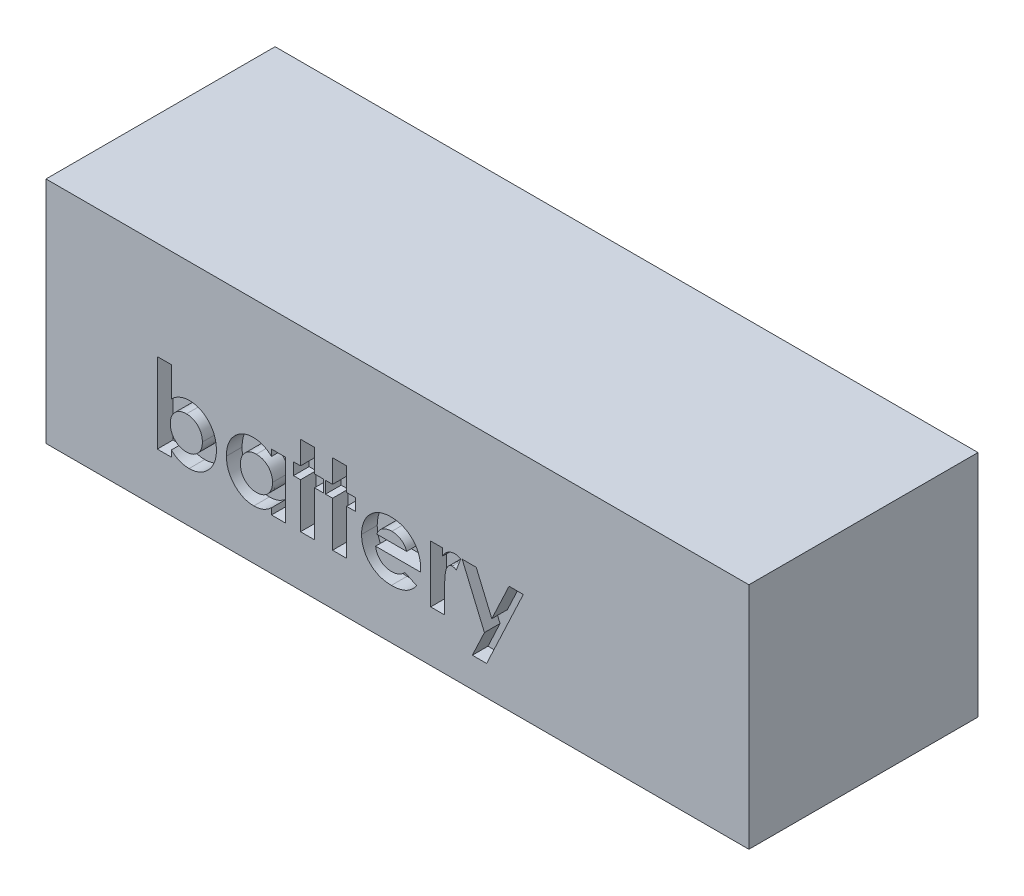
from build123d import *

# Parameters (mm, degrees)
SKETCH_1_W          = 135
SKETCH_1_H          = 44
EXTRUDE_1_DEPTH     = 44
CUT_EXTRUDE_1_DEPTH = 3


with BuildPart() as part:
    # ｽｹｯﾁ1 → ﾎﾞｽ - 押し出し1 (new body)
    with BuildSketch(Plane.XY):
        with Locations((67.5, 22)):
            Rectangle(SKETCH_1_W, SKETCH_1_H)
    extrude(amount=EXTRUDE_1_DEPTH)

    # ｽｹｯﾁ2 → ｶｯﾄ - 押し出し1 (cut)
    # profile 1 of 7: a face of its own
    with BuildSketch(Plane.XY.offset(44)):
        with BuildLine():
            Line((24.074722229, 25.14774532), (24.074722229, 19.447625128))
            add(Edge.make_bspline(
                [(24.074722229, 19.447625128), (24.199740685, 19.565337539), (24.445158571, 19.79641327), (24.845857096, 20.095219483), (25.260933041, 20.347409477), (25.690014561, 20.558985084), (26.136963428, 20.715436123), (26.596288067, 20.837004441), (27.072695046, 20.901389585), (27.394868954, 20.911751888), (27.557294345, 20.916976089)],
                knots=[0, 0, 0, 0, 1.061187343, 2.083167259, 3.083809127, 4.061667593, 5.035358583, 6.007314429, 6.995378812, 8, 8, 8, 8], degree=3))
            add(Edge.make_bspline(
                [(27.557294345, 20.916976089), (27.733852947, 20.912747065), (28.081616104, 20.904417261), (28.59328342, 20.826646571), (29.083624154, 20.700935602), (29.554508103, 20.525408828), (30.00342645, 20.297516625), (30.435423114, 20.024658742), (30.843047804, 19.695575564), (31.226498678, 19.322833687), (31.581200289, 18.914280901), (31.889725368, 18.470097312), (32.146714786, 17.996129229), (32.364525944, 17.497979945), (32.523493276, 16.967387819), (32.646012031, 16.41147039), (32.714286357, 15.825524477), (32.723746, 15.426355734), (32.728568383, 15.222865512)],
                knots=[0, 0, 0, 0, 0.985987466, 1.942075377, 2.884088208, 3.810275091, 4.743821533, 5.692411115, 6.659945104, 7.665215984, 8.677116751, 9.678438675, 10.680260931, 11.685531812, 12.710472044, 13.769734641, 14.863044265, 16, 16, 16, 16], degree=3))
            add(Edge.make_bspline(
                [(32.728568383, 15.222865512), (32.724004319, 15.026341303), (32.715007541, 14.638948756), (32.642319248, 14.07022462), (32.519118679, 13.526931847), (32.346293248, 13.008874775), (32.126585563, 12.514416254), (31.858417169, 12.043896993), (31.540223782, 11.598960505), (31.176446629, 11.185600535), (30.778967225, 10.811272353), (30.364822177, 10.47542555), (29.925763077, 10.200225432), (29.472765421, 9.967797849), (28.99869278, 9.790064974), (28.506783278, 9.665543118), (27.997815979, 9.582292533), (27.651780207, 9.574683754), (27.476164537, 9.570822243)],
                knots=[0, 0, 0, 0, 1.098553145, 2.165490463, 3.199345634, 4.208780719, 5.21409072, 6.219899742, 7.23156933, 8.267303578, 9.293302409, 10.281606823, 11.243293419, 12.184993323, 13.124258899, 14.066907486, 15.018941492, 16, 16, 16, 16], degree=3))
            add(Edge.make_bspline(
                [(27.476164537, 9.570822243), (27.319730468, 9.575004139), (27.011700412, 9.583238596), (26.557651289, 9.644311662), (26.121326568, 9.747024792), (25.697214428, 9.888512791), (25.284164117, 10.081826998), (24.874982354, 10.323541124), (24.467035734, 10.616713412), (24.208125782, 10.842636401), (24.074722229, 10.959043397)],
                knots=[0, 0, 0, 0, 0.996418773, 1.962021009, 2.912343664, 3.848616743, 4.805003894, 5.811808768, 6.872532775, 8, 8, 8, 8], degree=3))
            Line((24.074722229, 10.959043397), (24.074722229, 9.763129935))
            Line((24.074722229, 9.763129935), (21.382414537, 9.763129935))
            Line((21.382414537, 9.763129935), (21.382414537, 25.14774532))
            Line((21.382414537, 25.14774532), (24.074722229, 25.14774532))
        make_face()
        with BuildLine():
            add(Edge.make_bspline(
                [(26.974361653, 18.416976089), (26.865099774, 18.413616211), (26.650887096, 18.407029024), (26.33638387, 18.369277884), (26.038386525, 18.298248837), (25.752364254, 18.20618792), (25.481938922, 18.081920142), (25.224898143, 17.931282049), (24.983443495, 17.751657623), (24.756321835, 17.550159769), (24.552234967, 17.323474304), (24.370921489, 17.081249127), (24.220497806, 16.820330011), (24.095103271, 16.544025378), (24.000498573, 16.249345641), (23.930329296, 15.938797645), (23.892196742, 15.611429699), (23.885726844, 15.388220613), (23.882414537, 15.273947243)],
                knots=[0, 0, 0, 0, 1.060469436, 2.079096586, 3.066888298, 4.028858836, 4.99004353, 5.948472697, 6.914558426, 7.905691313, 8.889602648, 9.869280844, 10.836099585, 11.806137001, 12.808075328, 13.83377171, 14.890985086, 16, 16, 16, 16], degree=3))
            add(Edge.make_bspline(
                [(23.882414537, 15.273947243), (23.885768523, 15.157673996), (23.892350864, 14.929482742), (23.930165535, 14.595134114), (23.999842295, 14.278364407), (24.096439546, 13.978455425), (24.219700324, 13.695368255), (24.369945783, 13.428053453), (24.553255054, 13.182371758), (24.755099952, 12.949709575), (24.983625962, 12.745515637), (25.223992851, 12.562381763), (25.481876475, 12.411519127), (25.753594179, 12.289284732), (26.037084193, 12.187708619), (26.336571059, 12.119073744), (26.650837426, 12.080622492), (26.865082997, 12.07413253), (26.974361653, 12.070822243)],
                knots=[0, 0, 0, 0, 1.117193555, 2.192540452, 3.22680955, 4.227918444, 5.21468246, 6.188555072, 7.166222992, 8.154674427, 9.142376254, 10.104580718, 11.053462639, 12.005072638, 12.963662044, 13.941614018, 14.950094269, 16, 16, 16, 16], degree=3))
            add(Edge.make_bspline(
                [(26.974361653, 12.070822243), (27.079665331, 12.073897398), (27.288106209, 12.079984442), (27.593090526, 12.122457697), (27.886256438, 12.191863216), (28.165308067, 12.290791188), (28.43194411, 12.419595308), (28.688591945, 12.570317446), (28.926391124, 12.758633506), (29.154670906, 12.965608932), (29.358920323, 13.199017685), (29.542156597, 13.446983743), (29.696080512, 13.711720254), (29.818292473, 13.994105123), (29.919328586, 14.28878957), (29.988309127, 14.60116734), (30.026260957, 14.928450238), (30.032894331, 15.151657649), (30.036260691, 15.26493282)],
                knots=[0, 0, 0, 0, 1.021711385, 2.02240246, 2.981887075, 3.941027022, 4.888772411, 5.852236371, 6.822344989, 7.82661704, 8.838806642, 9.826383926, 10.814965113, 11.80282933, 12.807900643, 13.833672313, 14.900613836, 16, 16, 16, 16], degree=3))
            add(Edge.make_bspline(
                [(30.036260691, 15.26493282), (30.032840572, 15.377188896), (30.026101979, 15.598364795), (29.988927322, 15.922922302), (29.917290925, 16.230758637), (29.826840855, 16.524388597), (29.700473999, 16.799989885), (29.551057934, 17.060822821), (29.37524225, 17.30767497), (29.171288482, 17.533882533), (28.947587146, 17.739715164), (28.708789779, 17.921775824), (28.455834161, 18.076761318), (28.185275591, 18.198984936), (27.903498823, 18.299548632), (27.606197721, 18.368818236), (27.294883736, 18.40715591), (27.082637311, 18.413658731), (26.974361653, 18.416976089)],
                knots=[0, 0, 0, 0, 1.094680664, 2.156827393, 3.177782763, 4.17210342, 5.146667393, 6.126451192, 7.099203661, 8.094961544, 9.09004898, 10.058676268, 11.018205477, 11.974998356, 12.947750825, 13.930643515, 14.944335875, 16, 16, 16, 16], degree=3))
        make_face(mode=Mode.SUBTRACT)
    # profile 2 of 7: a face of its own
    with BuildSketch(Plane.XY.offset(44)):
        with BuildLine():
            Line((43.30549146, 20.724668397), (45.997799153, 20.724668397))
            Line((45.997799153, 20.724668397), (45.997799153, 9.763129935))
            Line((45.997799153, 9.763129935), (43.30549146, 9.763129935))
            Line((43.30549146, 9.763129935), (43.30549146, 10.959043397))
            add(Edge.make_bspline(
                [(43.30549146, 10.959043397), (43.172088606, 10.842634457), (42.91318001, 10.616707694), (42.505223842, 10.323561975), (42.096075578, 10.081754643), (41.683769251, 9.88916829), (41.261967884, 9.74696309), (40.827634678, 9.644003204), (40.374514772, 9.58328524), (40.066490102, 9.575019849), (39.910058768, 9.570822243)],
                knots=[0, 0, 0, 0, 1.129196829, 2.191548051, 3.199897424, 4.157751732, 5.089409408, 6.034969131, 7.002052659, 8, 8, 8, 8], degree=3))
            add(Edge.make_bspline(
                [(39.910058768, 9.570822243), (39.734457642, 9.574772719), (39.387459864, 9.582579084), (38.878279148, 9.664753667), (38.386614546, 9.790540183), (37.912865152, 9.968543825), (37.457892911, 10.199201648), (37.018215905, 10.476495468), (36.601371537, 10.810159956), (36.203889722, 11.1857583), (35.839957755, 11.598919151), (35.521804995, 12.043907893), (35.253625863, 12.514413342), (35.033921051, 13.008875558), (34.861094844, 13.526931632), (34.737894488, 14.07022468), (34.665206137, 14.638948741), (34.656209367, 15.026341298), (34.651645306, 15.222865512)],
                knots=[0, 0, 0, 0, 0.980476535, 1.937477201, 2.874147792, 3.812856188, 4.758993464, 5.720109578, 6.712210464, 7.737600662, 8.772720504, 9.783789959, 10.789002326, 11.793715968, 12.802552247, 13.835794126, 14.902098527, 16, 16, 16, 16], degree=3))
            add(Edge.make_bspline(
                [(34.651645306, 15.222865512), (34.656435305, 15.426366594), (34.665831421, 15.825556642), (34.734563449, 16.411349057), (34.855490294, 16.968113012), (35.02038274, 17.496619706), (35.23248824, 17.996960444), (35.490818566, 18.469954945), (35.798888061, 18.914366876), (36.153883542, 19.322632035), (36.537191469, 19.696826773), (36.947263189, 20.022592967), (37.377686076, 20.299346506), (37.82891753, 20.525284794), (38.300893112, 20.699878468), (38.791749471, 20.827520701), (39.303665663, 20.904110523), (39.652387121, 20.912651952), (39.82892896, 20.916976089)],
                knots=[0, 0, 0, 0, 1.136281865, 2.228943489, 3.287578264, 4.313574083, 5.316051562, 6.317280042, 7.318008486, 8.329309503, 9.333984563, 10.305318864, 11.248632312, 12.186624717, 13.117503092, 14.05354244, 15.014596925, 16, 16, 16, 16], degree=3))
            add(Edge.make_bspline(
                [(39.82892896, 20.916976089), (39.992463906, 20.913578616), (40.316040619, 20.906856243), (40.791651764, 20.833864127), (41.252925978, 20.723468735), (41.697346987, 20.566175173), (42.128560078, 20.367560051), (42.539148116, 20.118680498), (42.938093084, 19.829996812), (43.18151224, 19.604528738), (43.30549146, 19.489692435)],
                knots=[0, 0, 0, 0, 1.017011718, 2.012299608, 2.98747302, 3.965332399, 4.941441765, 5.936729654, 6.94912688, 8, 8, 8, 8], degree=3))
            Line((43.30549146, 19.489692435), (43.30549146, 20.724668397))
        make_face()
        with BuildLine():
            add(Edge.make_bspline(
                [(40.393832806, 18.416976089), (40.286552281, 18.413684352), (40.076289457, 18.407232763), (39.767069199, 18.368426004), (39.471547394, 18.300046764), (39.191831682, 18.199031122), (38.923753269, 18.075979352), (38.671382969, 17.921859035), (38.432637894, 17.739692096), (38.208922127, 17.533888793), (38.004972244, 17.307673336), (37.829155541, 17.060823258), (37.679739748, 16.799989768), (37.553372819, 16.524388629), (37.462922769, 16.230758628), (37.391286367, 15.922922305), (37.354111711, 15.598364794), (37.347373118, 15.377188896), (37.343952999, 15.26493282)],
                knots=[0, 0, 0, 0, 1.04836806, 2.054732945, 3.03993516, 4.00574415, 4.955904794, 5.917688631, 6.888591924, 7.88601754, 8.884115178, 9.859153345, 10.841239365, 11.818093293, 12.814750328, 13.83810466, 14.90274714, 16, 16, 16, 16], degree=3))
            add(Edge.make_bspline(
                [(37.343952999, 15.26493282), (37.347320875, 15.151658516), (37.353957236, 14.928452815), (37.391887445, 14.601157546), (37.460946074, 14.288824457), (37.561700009, 13.993978549), (37.684743936, 13.712641376), (37.834516065, 13.446111335), (38.018484893, 13.199101011), (38.222613561, 12.965765309), (38.450918821, 12.757405584), (38.691014813, 12.572401277), (38.946181058, 12.417608292), (39.213649182, 12.292503623), (39.492518876, 12.190553833), (39.78628632, 12.123033981), (40.092073692, 12.079869817), (40.300537018, 12.073858926), (40.405852037, 12.070822243)],
                knots=[0, 0, 0, 0, 1.099136573, 2.165835871, 3.191374663, 4.196217796, 5.183857741, 6.167377911, 7.154730987, 8.166690795, 9.170734848, 10.148332609, 11.103258353, 12.059567475, 13.009337315, 13.978056681, 14.978520572, 16, 16, 16, 16], degree=3))
            add(Edge.make_bspline(
                [(40.405852037, 12.070822243), (40.515130787, 12.074132434), (40.729376544, 12.080622208), (41.043641574, 12.119074814), (41.343133296, 12.187704772), (41.626605664, 12.289298751), (41.898388449, 12.411467253), (42.156029055, 12.562575941), (42.396731692, 12.744324857), (42.621715411, 12.951988628), (42.827869618, 13.180051271), (43.006117727, 13.430138395), (43.161378351, 13.694251527), (43.283483688, 13.978635265), (43.380452449, 14.278314221), (43.450025299, 14.595148265), (43.487868896, 14.929478984), (43.494447216, 15.157672727), (43.497799153, 15.273947243)],
                knots=[0, 0, 0, 0, 1.050008698, 2.058587853, 3.036635738, 3.995319155, 4.947022481, 5.895997462, 6.858296291, 7.838991643, 8.833936038, 9.806048392, 10.784806122, 11.771666913, 12.772873988, 13.80724452, 14.882696879, 16, 16, 16, 16], degree=3))
            add(Edge.make_bspline(
                [(43.497799153, 15.273947243), (43.494488867, 15.388221892), (43.488022917, 15.611433478), (43.44986209, 15.938783529), (43.379795312, 16.249396399), (43.284822328, 16.543843036), (43.160544699, 16.82145019), (43.005166601, 17.07913986), (42.828873771, 17.325840028), (42.620437139, 17.547741436), (42.396672209, 17.753901562), (42.152429648, 17.930154258), (41.895404425, 18.082053724), (41.624017371, 18.206769042), (41.335755564, 18.298190099), (41.03575203, 18.368974078), (40.719326093, 18.407209472), (40.504101129, 18.413667423), (40.393832806, 18.416976089)],
                knots=[0, 0, 0, 0, 1.106611376, 2.161533483, 3.185006901, 4.184773755, 5.152708835, 6.122342771, 7.094156588, 8.082475533, 9.064254463, 10.03606828, 10.992420271, 11.951521816, 12.920622147, 13.915721683, 14.932141191, 16, 16, 16, 16], degree=3))
        make_face(mode=Mode.SUBTRACT)
    # profile 3 of 7: a face of its own
    with BuildSketch(Plane.XY.offset(44)):
        Polygon((48.882414537, 25.14774532), (51.574722229, 25.14774532), (51.574722229, 20.724668397), (53.30549146, 20.724668397), (53.30549146, 18.416976089), (51.574722229, 18.416976089), (51.574722229, 9.763129935), (48.882414537, 9.763129935), (48.882414537, 18.416976089), (47.536260691, 18.416976089), (47.536260691, 20.724668397), (48.882414537, 20.724668397), align=None)
    # profile 4 of 7: a face of its own
    with BuildSketch(Plane.XY.offset(44)):
        Polygon((55.036260691, 25.14774532), (57.728568383, 25.14774532), (57.728568383, 20.724668397), (59.459337614, 20.724668397), (59.459337614, 18.416976089), (57.728568383, 18.416976089), (57.728568383, 9.763129935), (55.036260691, 9.763129935), (55.036260691, 18.416976089), (53.690106845, 18.416976089), (53.690106845, 20.724668397), (55.036260691, 20.724668397), align=None)
    # profile 5 of 7: a face of its own
    with BuildSketch(Plane.XY.offset(44)):
        with BuildLine():
            Line((71.950323191, 14.570822243), (63.30549146, 14.570822243))
            add(Edge.make_bspline(
                [(63.30549146, 14.570822243), (63.323117574, 14.470374203), (63.357754278, 14.272985878), (63.432969113, 13.98626221), (63.528954523, 13.716058664), (63.643986992, 13.462014045), (63.776127073, 13.222785319), (63.930257531, 12.999494561), (64.10442336, 12.792338999), (64.29761758, 12.60221895), (64.506619995, 12.431867266), (64.73041702, 12.282628421), (64.969239598, 12.160261698), (65.220349721, 12.057119249), (65.485623757, 11.975419979), (65.765452124, 11.919073547), (66.059093039, 11.885789503), (66.2591302, 11.880975347), (66.361380883, 11.878514551)],
                knots=[0, 0, 0, 0, 1.091296461, 2.144483647, 3.168565212, 4.157007626, 5.126487748, 6.090021542, 7.05641414, 8.019231907, 8.98705074, 9.938580405, 10.892824166, 11.854447369, 12.841318655, 13.858982407, 14.905600794, 16, 16, 16, 16], degree=3))
            add(Edge.make_bspline(
                [(66.361380883, 11.878514551), (66.484804399, 11.881773051), (66.727861648, 11.888189997), (67.083942328, 11.945098779), (67.428324215, 12.031056992), (67.757748243, 12.158884071), (68.076030272, 12.318006314), (68.377930402, 12.516253049), (68.668674288, 12.74783086), (68.846062322, 12.926330947), (68.936501076, 13.017336666)],
                knots=[0, 0, 0, 0, 1.021034703, 2.010718019, 2.977989445, 3.954245119, 4.929443971, 5.918328161, 6.938689359, 8, 8, 8, 8], degree=3))
            Line((68.936501076, 13.017336666), (71.190106845, 11.94462032))
            add(Edge.make_bspline(
                [(71.190106845, 11.94462032), (71.119153382, 11.846573525), (70.978561706, 11.652297405), (70.749050513, 11.37890073), (70.509540968, 11.123810541), (70.259854446, 10.888704605), (69.999674282, 10.674252881), (69.729724234, 10.477842959), (69.446059093, 10.304748368), (69.154350691, 10.146594895), (68.848568877, 10.011010657), (68.529559885, 9.895389204), (68.198674894, 9.790868394), (67.851735545, 9.711229263), (67.491630796, 9.648187576), (67.117499208, 9.603419627), (66.729390088, 9.57576861), (66.465594581, 9.572490616), (66.331332806, 9.570822243)],
                knots=[0, 0, 0, 0, 1.028154879, 2.037251081, 3.030720504, 4.000128189, 4.949298328, 5.894184978, 6.834267904, 7.770992897, 8.712077017, 9.673380525, 10.653304757, 11.658697181, 12.695551717, 13.758623199, 14.859225354, 16, 16, 16, 16], degree=3))
            add(Edge.make_bspline(
                [(66.331332806, 9.570822243), (66.124773271, 9.57503337), (65.720238326, 9.583280621), (65.12853284, 9.659826908), (64.566576745, 9.786748904), (64.032783271, 9.959279863), (63.52945983, 10.18707478), (63.056357326, 10.46568686), (62.608748788, 10.789774551), (62.200311156, 11.166139592), (61.828212423, 11.575790563), (61.501384032, 12.015727733), (61.227898688, 12.482877426), (61.003307023, 12.974147949), (60.828746579, 13.49079676), (60.702898624, 14.033049316), (60.62575232, 14.600646626), (60.617420136, 14.987243754), (60.613183768, 15.183803012)],
                knots=[0, 0, 0, 0, 1.103565453, 2.161269334, 3.182010356, 4.179077853, 5.15417608, 6.128274628, 7.109042802, 8.101804412, 9.090965879, 10.063106201, 11.02526161, 11.978650795, 12.945248442, 13.93468508, 14.949922959, 16, 16, 16, 16], degree=3))
            add(Edge.make_bspline(
                [(60.613183768, 15.183803012), (60.617461831, 15.385357093), (60.625878728, 15.781905696), (60.702234395, 16.362609087), (60.829094506, 16.916678666), (61.004165577, 17.444877445), (61.225350159, 17.948857403), (61.502315134, 18.424209319), (61.828050236, 18.87258811), (62.198808491, 19.291896216), (62.60897639, 19.670367591), (63.044818535, 20.007661221), (63.511232059, 20.288716662), (64.002941423, 20.515809284), (64.516801476, 20.700316307), (65.058751723, 20.823090321), (65.624668749, 20.905525723), (66.011517165, 20.913117509), (66.208135691, 20.916976089)],
                knots=[0, 0, 0, 0, 1.079208495, 2.12329425, 3.130605359, 4.119693003, 5.099659317, 6.073216462, 7.060498243, 8.06384408, 9.066070512, 10.045757761, 11.010926815, 11.975797609, 12.942977511, 13.929384301, 14.947594487, 16, 16, 16, 16], degree=3))
            add(Edge.make_bspline(
                [(66.208135691, 20.916976089), (66.415684787, 20.912699629), (66.823186047, 20.904303241), (67.419012579, 20.828378491), (67.984699995, 20.700682541), (68.522658441, 20.529643424), (69.026017967, 20.296094169), (69.505838907, 20.024338291), (69.950612435, 19.693245198), (70.365079363, 19.318721967), (70.739220471, 18.903201421), (71.066261255, 18.451818843), (71.344532711, 17.968979463), (71.570074487, 17.452725263), (71.744455689, 16.904606089), (71.870420139, 16.325333782), (71.946978001, 15.712705067), (71.955155142, 15.293203075), (71.959337614, 15.078634743)],
                knots=[0, 0, 0, 0, 1.080001299, 2.120471247, 3.119684163, 4.095710327, 5.052285597, 6.002875087, 6.961153713, 7.931888285, 8.906493152, 9.865905668, 10.82813294, 11.801621613, 12.7925306, 13.817193356, 14.883530496, 16, 16, 16, 16], degree=3))
            Line((71.959337614, 15.078634743), (71.950323191, 14.570822243))
        make_face()
        with BuildLine():
            add(Edge.make_bspline(
                [(69.267029922, 16.686206858), (69.216224429, 16.823310303), (69.115209874, 17.095907667), (68.8870222, 17.472025514), (68.584224456, 17.797758846), (68.232048958, 18.086133147), (67.8296664, 18.320195743), (67.38975656, 18.489664664), (66.917879815, 18.591280356), (66.593254042, 18.603198091), (66.427486653, 18.609283781)],
                knots=[0, 0, 0, 0, 0.954238005, 1.897273737, 2.851915805, 3.847685534, 4.862635127, 5.880135777, 6.917509367, 8, 8, 8, 8], degree=3))
            add(Edge.make_bspline(
                [(66.427486653, 18.609283781), (66.246441674, 18.603437735), (65.892536438, 18.592009932), (65.38205223, 18.470471047), (64.900525251, 18.289077892), (64.616644236, 18.102057698), (64.474361653, 18.008322243)],
                knots=[0, 0, 0, 0, 1.044195649, 2.041185066, 3.018232172, 4, 4, 4, 4], degree=3))
            add(Edge.make_bspline(
                [(64.474361653, 18.008322243), (64.385587947, 17.936931267), (64.196326946, 17.784729356), (63.950533139, 17.481100993), (63.708424193, 17.113475206), (63.570771909, 16.834237448), (63.497799153, 16.686206858)],
                knots=[0, 0, 0, 0, 0.82159062, 1.751589201, 2.808063854, 4, 4, 4, 4], degree=3))
            Line((63.497799153, 16.686206858), (69.267029922, 16.686206858))
        make_face(mode=Mode.SUBTRACT)
    # profile 6 of 7: a face of its own
    with BuildSketch(Plane.XY.offset(44)):
        with BuildLine():
            Line((73.882414537, 20.724668397), (76.190106845, 20.724668397))
            Line((76.190106845, 20.724668397), (76.190106845, 19.375509743))
            add(Edge.make_bspline(
                [(76.190106845, 19.375509743), (76.25538703, 19.495409844), (76.38297986, 19.729759565), (76.617378591, 20.044327657), (76.886665345, 20.309248127), (77.181163819, 20.530062028), (77.501766579, 20.702164783), (77.839888455, 20.824809692), (78.192636819, 20.904511888), (78.433269795, 20.912791439), (78.554890499, 20.916976089)],
                knots=[0, 0, 0, 0, 1.09866127, 2.147379032, 3.14564304, 4.131443017, 5.102343063, 6.064490016, 7.021754664, 8, 8, 8, 8], degree=3))
            add(Edge.make_bspline(
                [(78.554890499, 20.916976089), (78.643202305, 20.91284078), (78.823036678, 20.904419815), (79.097129568, 20.855468618), (79.375177137, 20.766955545), (79.558156397, 20.687261286), (79.651645306, 20.646543397)],
                knots=[0, 0, 0, 0, 0.931404136, 1.896671404, 2.925354185, 4, 4, 4, 4], degree=3))
            Line((79.651645306, 20.646543397), (78.816308768, 18.365894358))
            add(Edge.make_bspline(
                [(78.816308768, 18.365894358), (78.74164161, 18.401969919), (78.601296096, 18.469778085), (78.397538779, 18.549798707), (78.212620566, 18.59862338), (78.095385813, 18.605908449), (78.041068383, 18.609283781)],
                knots=[0, 0, 0, 0, 1.214386998, 2.282580073, 3.20428172, 4, 4, 4, 4], degree=3))
            add(Edge.make_bspline(
                [(78.041068383, 18.609283781), (77.989782167, 18.607047108), (77.888893342, 18.602647186), (77.73998426, 18.56494135), (77.599742913, 18.499918804), (77.461411078, 18.416618469), (77.335901604, 18.300824774), (77.210469655, 18.166773011), (77.099932305, 18.001268281), (76.983283343, 17.81705311), (76.883960924, 17.591573907), (76.798795007, 17.322398204), (76.722911492, 17.006411455), (76.670693273, 16.641935922), (76.620222267, 16.232498537), (76.590180686, 15.77509408), (76.567790315, 15.271168907), (76.566421294, 14.91941095), (76.565707806, 14.736086666)],
                knots=[0, 0, 0, 0, 0.544232178, 1.070598461, 1.618251235, 2.182094276, 2.777567932, 3.425210017, 4.127676488, 4.886675562, 5.738955394, 6.734782583, 7.883056018, 9.186093582, 10.642914445, 12.264202625, 14.053029461, 16, 16, 16, 16], degree=3))
            Line((76.565707806, 14.736086666), (76.574722229, 14.201230897))
            Line((76.574722229, 14.201230897), (76.574722229, 9.763129935))
            Line((76.574722229, 9.763129935), (73.882414537, 9.763129935))
            Line((73.882414537, 9.763129935), (73.882414537, 20.724668397))
        make_face()
    # profile 7 of 7: a face of its own
    with BuildSketch(Plane.XY.offset(44)):
        Polygon((79.934097229, 20.724668397), (82.629409729, 20.724668397), (85.622198191, 13.672384743), (88.933496268, 20.724668397), (91.670876076, 20.724668397), (84.624602037, 5.724668397), (81.887222229, 5.724668397), (84.20392896, 10.65555782), align=None)
    extrude(amount=-CUT_EXTRUDE_1_DEPTH, mode=Mode.SUBTRACT)


solid = part.part
